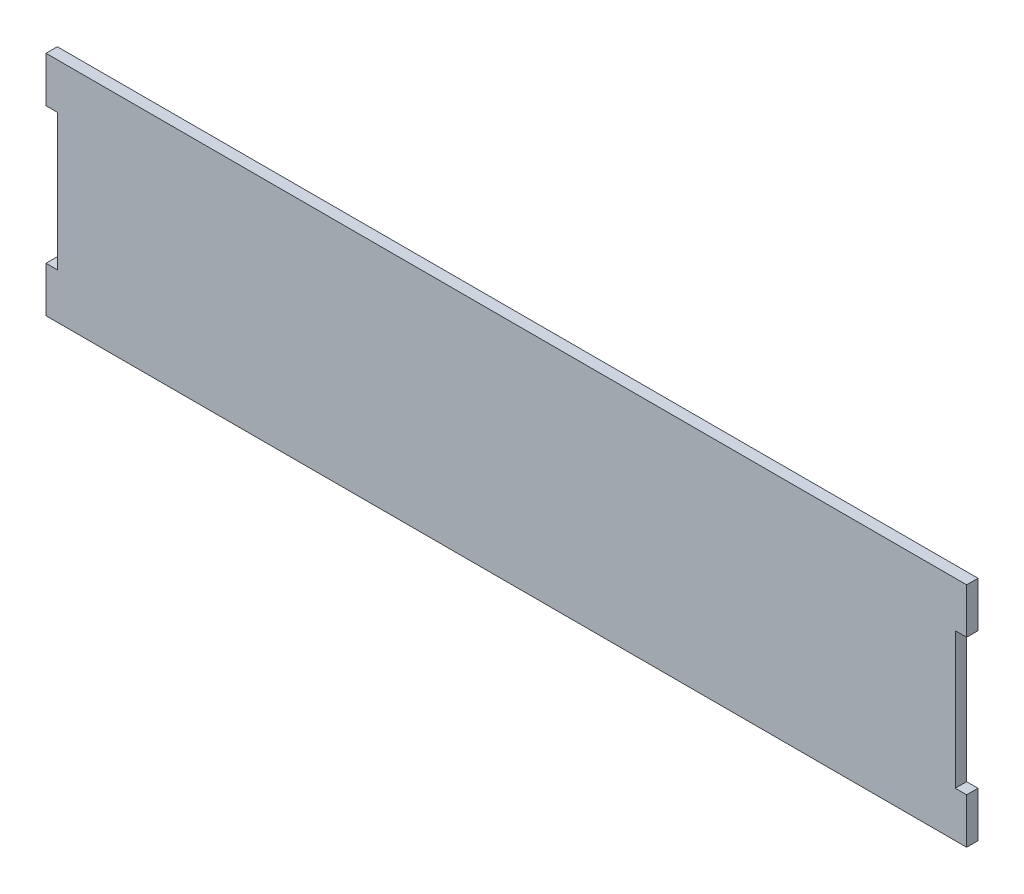
from build123d import *

# Parameters (mm, degrees)
SKETCH1_W           = 405
SKETCH1_H           = 100
BOSS_EXTRUDE1_DEPTH = 5
SKETCH2_W           = 5
SKETCH2_H           = 5
CUT_EXTRUDE1_DEPTH  = 5
BOSS_EXTRUDE2_DEPTH = 5
SKETCH6_W           = 15
SKETCH6_H           = 50
CUT_EXTRUDE4_DEPTH  = 5


with BuildPart() as part:
    # Sketch1 → Boss-Extrude1 (new body)
    with BuildSketch(Plane.XY):
        with Locations((-202.5, -50)):
            Rectangle(SKETCH1_W, SKETCH1_H)
    extrude(amount=BOSS_EXTRUDE1_DEPTH)

    # Sketch2 → Cut-Extrude1 (cut)
    with BuildSketch(Plane.XY.offset(5)):
        with Locations((-402.5, -77.5)):
            Rectangle(SKETCH2_W, SKETCH2_H)
        with Locations((-402.5, -22.5)):
            Rectangle(SKETCH2_W, SKETCH2_H)
        with Locations((-2.5, -22.5)):
            Rectangle(SKETCH2_W, SKETCH2_H)
        with Locations((-2.5, -77.5)):
            Rectangle(SKETCH2_W, SKETCH2_H)
    extrude(amount=-CUT_EXTRUDE1_DEPTH, mode=Mode.SUBTRACT)

    # Sketch3 → Boss-Extrude2 (add)
    with BuildSketch(Plane.XY.offset(5)):
        Polygon((-405, -30), (-405, -25), (-415, -25), (-415, -75), (-405, -75), (-405, -70), (-410, -70), (-410, -30), align=None)
        Polygon((0, -30), (5, -30), (5, -70), (0, -70), (0, -75), (10, -75), (10, -25), (0, -25), align=None)
    extrude(amount=-BOSS_EXTRUDE2_DEPTH)

    # Sketch6 → Cut-Extrude4 (cut)
    with BuildSketch(Plane.XY.offset(5)):
        with Locations((2.5, -50)):
            Rectangle(SKETCH6_W, SKETCH6_H)
        with Locations((-407.5, -50)):
            Rectangle(SKETCH6_W, SKETCH6_H)
    extrude(amount=-CUT_EXTRUDE4_DEPTH, mode=Mode.SUBTRACT)


solid = part.part
